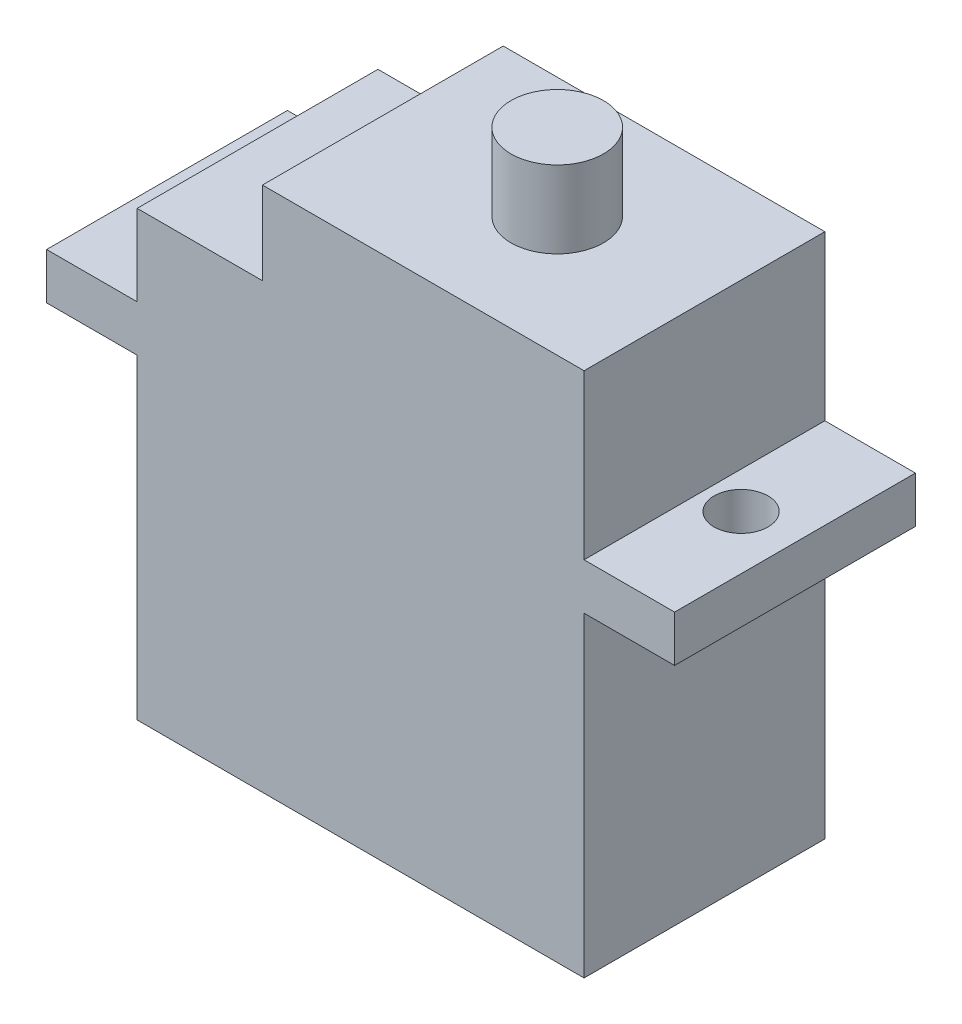
from build123d import *

# Parameters (mm, degrees)
BOSS_EXTRUDE1_DEPTH = 12.5
SKETCH2_R           = 1.4
CUT_EXTRUDE1_DEPTH  = 12.5
SKETCH3_R           = 2.4
BOSS_EXTRUDE2_DEPTH = 4


with BuildPart() as part:
    # Sketch1 → Boss-Extrude1 (new body)
    with BuildSketch(Plane.XY):
        Polygon((0, 18.8), (0, 23), (6.504024825, 23), (6.504024825, 27.3), (23.2, 27.3), (23.2, 23), (23.2, 18.8), (27.9, 18.8), (27.9, 16.4), (23.2, 16.4), (23.2, 0), (0, 0), (0, 16.4), (-4.7, 16.4), (-4.7, 18.8), align=None)
    extrude(amount=BOSS_EXTRUDE1_DEPTH)

    # Sketch2 → Cut-Extrude1 (cut)
    with BuildSketch(Plane(origin=(0, 27.3, 0), x_dir=(1, 0, 0), z_dir=(0, 1, 0))):
        with Locations(Location((-1.9, -6.25, 0), (0, 0, 270))):
            Circle(SKETCH2_R)
        with Locations(Location((25.1, -6.25, 0), (0, 0, 270))):
            Circle(SKETCH2_R)
    extrude(amount=-CUT_EXTRUDE1_DEPTH, mode=Mode.SUBTRACT)

    # Sketch3 → Boss-Extrude2 (add)
    with BuildSketch(Plane(origin=(0, 27.3, 0), x_dir=(1, 0, 0), z_dir=(0, 1, 0))):
        with Locations(Location((15.556949647, -6.25, 0), (0, 0, 270))):
            Circle(SKETCH3_R)
    extrude(amount=BOSS_EXTRUDE2_DEPTH)


solid = part.part
